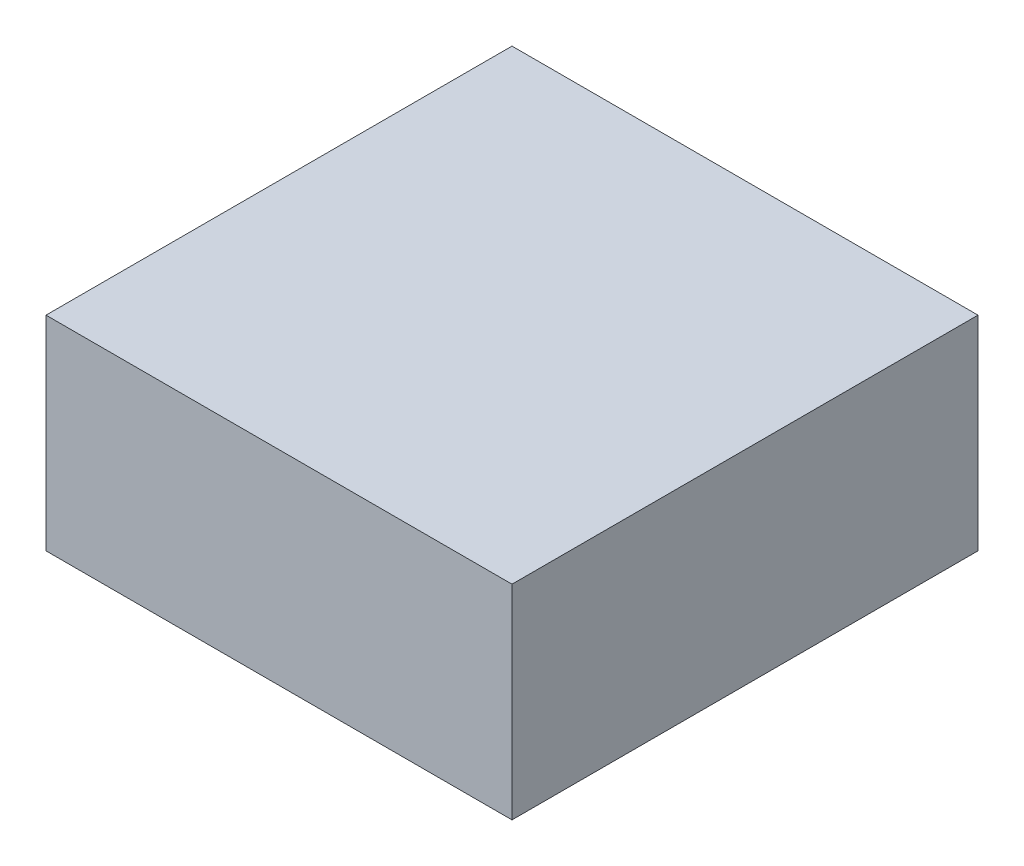
from build123d import *

# Parameters (mm, degrees)
SKETCH1_W           = 210
SKETCH1_H           = 210
BOSS_EXTRUDE1_DEPTH = 92


with BuildPart() as part:
    # Sketch1 → Boss-Extrude1 (new body)
    with BuildSketch(Plane(origin=(0, 0, 0), x_dir=(1, 0, 0), z_dir=(0, 1, 0))):
        Rectangle(SKETCH1_W, SKETCH1_H)
    extrude(amount=BOSS_EXTRUDE1_DEPTH)


solid = part.part
